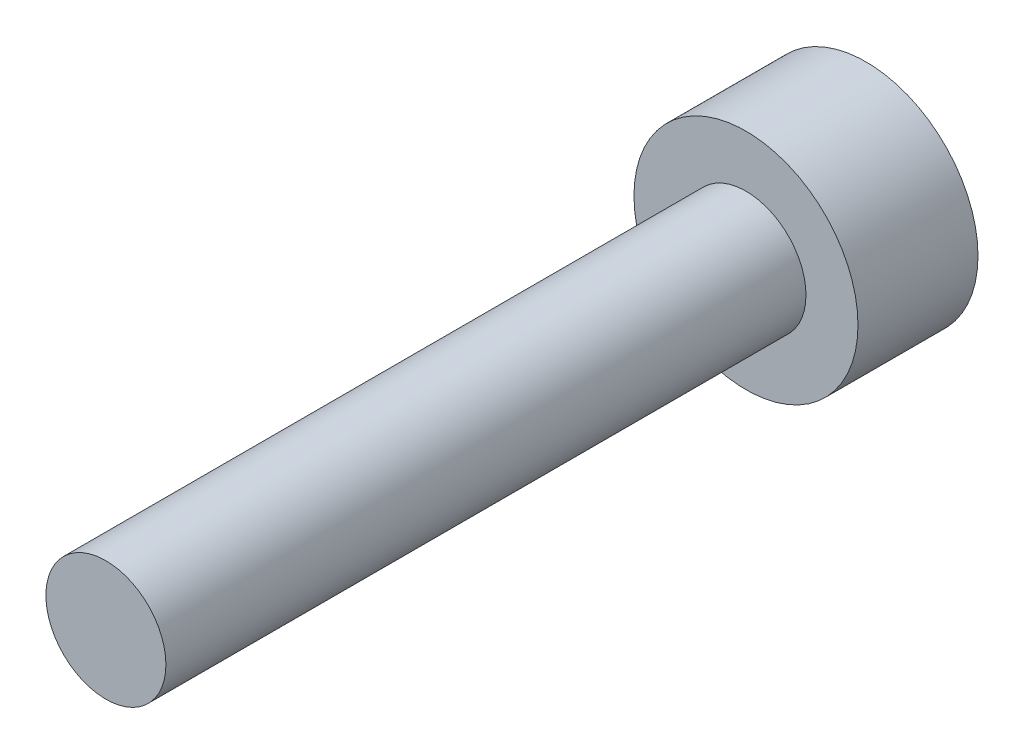
from build123d import *

# Parameters (mm, degrees)
HEAD_START       = -3
SKETCH1_R        = 2.8
HEAD_DEPTH       = 3
SKETCH2_R        = 1.5
SHANK_DEPTH      = 16
HEX_START        = -3.2
HEX_SOCKET_DEPTH = 1.8


with BuildPart() as part:
    # Sketch1 → Head (new body)
    with BuildSketch(Plane.XY.offset(HEAD_START)):
        Circle(SKETCH1_R)
    extrude(amount=HEAD_DEPTH)

    # Sketch2 → Shank (add)
    with BuildSketch(Plane.XY):
        Circle(SKETCH2_R)
    extrude(amount=SHANK_DEPTH)

    # Sketch3 → Hex socket (cut)
    with BuildSketch(Plane.XY.offset(HEX_START)):
        Polygon((1.25, 0.721687836), (0, 1.443375673), (-1.25, 0.721687836), (-1.25, -0.721687836), (0, -1.443375673), (1.25, -0.721687836), align=None)
    extrude(amount=HEX_SOCKET_DEPTH, mode=Mode.SUBTRACT)


solid = part.part
